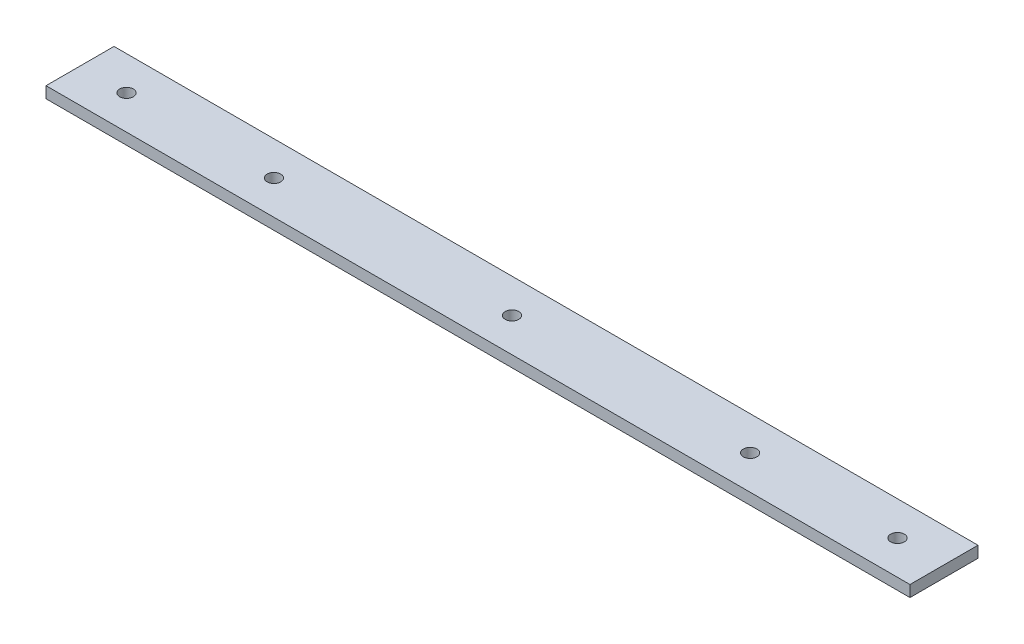
from build123d import *

# Parameters (mm, degrees)
SKETCH1_W           = 381
SKETCH1_H           = 30
SKETCH1_R           = 3
BOSS_EXTRUDE1_DEPTH = 5


with BuildPart() as part:
    # Sketch1 → Boss-Extrude1 (new body)
    with BuildSketch(Plane(origin=(0, 0, 0), x_dir=(1, 0, 0), z_dir=(0, 1, 0))):
        with Locations((190.5, 15)):
            Rectangle(SKETCH1_W, SKETCH1_H)
        with Locations(Location((190.5, 15, 0), (0, 0, 270))):
            Circle(SKETCH1_R, mode=Mode.SUBTRACT)
        with Locations(Location((295.5, 15, 0), (0, 0, 270))):
            Circle(SKETCH1_R, mode=Mode.SUBTRACT)
        with Locations(Location((360.5, 15, 0), (0, 0, 270))):
            Circle(SKETCH1_R, mode=Mode.SUBTRACT)
        with Locations(Location((20.5, 15, 0), (0, 0, 90))):
            Circle(SKETCH1_R, mode=Mode.SUBTRACT)
        with Locations(Location((85.5, 15, 0), (0, 0, 90))):
            Circle(SKETCH1_R, mode=Mode.SUBTRACT)
    extrude(amount=BOSS_EXTRUDE1_DEPTH)


solid = part.part
